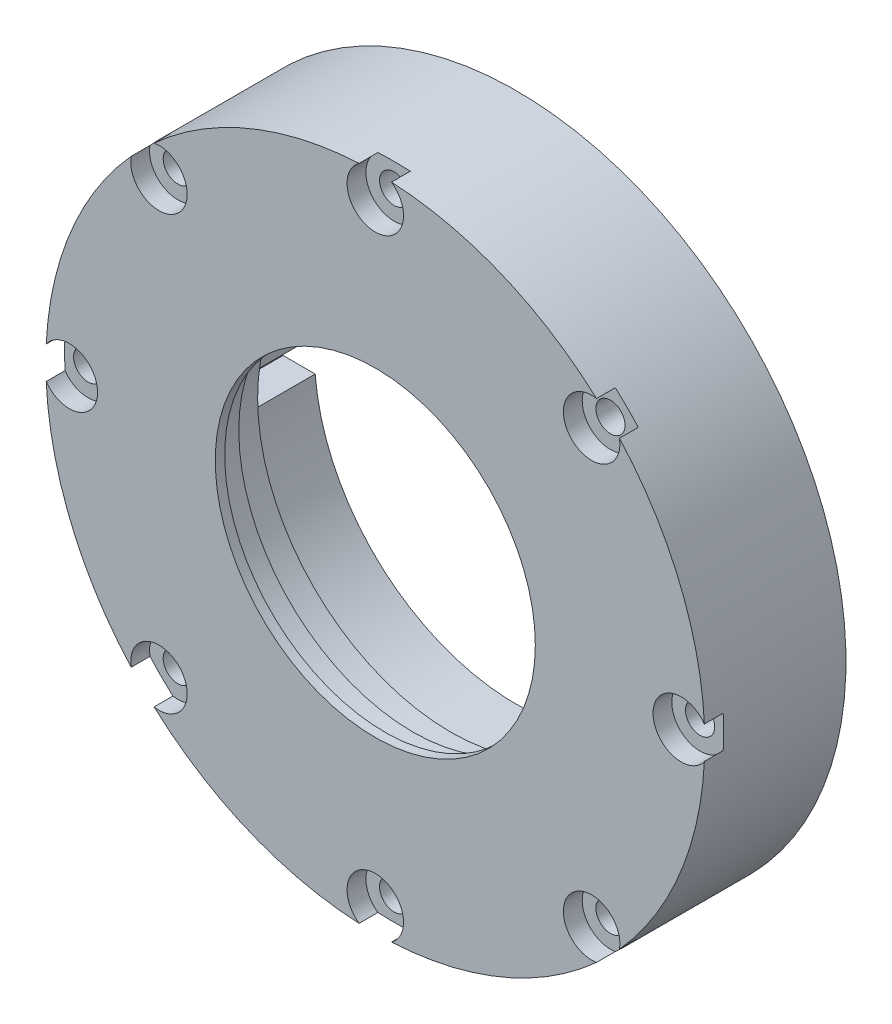
from build123d import *

# Parameters (mm, degrees)
SKETCH_1_R          = 35
SKETCH_1_R_2        = 18.5
EXTRUDE_1_DEPTH     = 3
SKETCH_5_R          = 35
SKETCH_5_R_2        = 17
EXTRUDE_3_DEPTH     = 1
EXTRUDE_START       = 4
SKETCH_7_R          = 35
SKETCH_7_R_2        = 21.45
EXTRUDE_4_DEPTH     = 4
EXTRUDE_START_2     = 7
SKETCH_9_R          = 35
EXTRUDE_6_DEPTH     = 7
SKETCH_12_R         = 1.55
CUT_EXTRUDE_1_DEPTH = 52.720402164
SKETCH_13_R         = 3
CUT_EXTRUDE_2_DEPTH = 2
SKETCH_15_R         = 1.55
CUT_EXTRUDE_3_DEPTH = 52.720402164
SKETCH_16_R         = 3
CUT_EXTRUDE_4_DEPTH = 2
SKETCH_17_R         = 21.45
SKETCH_17_R_2       = 20.5
EXTRUDE_7_DEPTH     = 4


with BuildPart() as part:
    # 草图1 → 凸台-拉伸1 (new body)
    with BuildSketch(Plane.XY):
        Circle(SKETCH_1_R)
        Circle(SKETCH_1_R_2, mode=Mode.SUBTRACT)
    extrude(amount=EXTRUDE_1_DEPTH)

    # 草图5 → 凸台-拉伸3 (add)
    with BuildSketch(Plane.XY.offset(3)):
        Circle(SKETCH_5_R)
        Circle(SKETCH_5_R_2, mode=Mode.SUBTRACT)
    extrude(amount=EXTRUDE_3_DEPTH)

    # 草图7 → 凸台-拉伸4 (add)
    with BuildSketch(Plane(origin=(0, 0, 0), x_dir=(-1, 0, 0), z_dir=(0, 0, -1)).offset(EXTRUDE_START)):
        Circle(SKETCH_7_R)
        Circle(SKETCH_7_R_2, mode=Mode.SUBTRACT)
    extrude(amount=-EXTRUDE_4_DEPTH)

    # 草图9 → 凸台-拉伸6 (add)
    with BuildSketch(Plane(origin=(0, 0, -4), x_dir=(-1, 0, 0), z_dir=(0, 0, -1)).offset(EXTRUDE_START_2)):
        Circle(SKETCH_9_R)
        with BuildLine():
            Line((24.8, 1.75), (24.8, 0))
            Line((24.8, 0), (24.8, -1.75))
            Line((24.8, -1.75), (21.382497565, -1.75))
            ThreePointArc((21.382497565, -1.75), (0, -21.453990354), (-21.382497565, -1.75))
            Line((-21.382497565, -1.75), (-24.8, -1.75))
            Line((-24.8, -1.75), (-24.8, 1.75))
            Line((-24.8, 1.75), (-21.382497565, 1.75))
            ThreePointArc((-21.382497565, 1.75), (0, 21.453990354), (21.382497565, 1.75))
            Line((21.382497565, 1.75), (24.8, 1.75))
        make_face(mode=Mode.SUBTRACT)
    extrude(amount=-EXTRUDE_6_DEPTH)

    # 草图12 → 切除-拉伸1 (cut, through all)
    with BuildSketch(Plane.XY.offset(4)):
        with Locations((0, 32.5)):
            Circle(SKETCH_12_R)
        with Locations((-32.5, 0)):
            Circle(SKETCH_12_R)
        with Locations((0, -32.5)):
            Circle(SKETCH_12_R)
        with Locations((32.5, 0)):
            Circle(SKETCH_12_R)
    extrude(amount=-CUT_EXTRUDE_1_DEPTH, mode=Mode.SUBTRACT)

    # 草图13 → 切除-拉伸2 (cut)
    with BuildSketch(Plane.XY.offset(4)):
        with Locations((0, 32.5)):
            Circle(SKETCH_13_R)
        with Locations((32.5, 0)):
            Circle(SKETCH_13_R)
        with Locations((0, -32.5)):
            Circle(SKETCH_13_R)
        with Locations((-32.5, 0)):
            Circle(SKETCH_13_R)
    extrude(amount=-CUT_EXTRUDE_2_DEPTH, mode=Mode.SUBTRACT)

    # 草图15 → 切除-拉伸3 (cut, through all)
    with BuildSketch(Plane.XY.offset(4)):
        with Locations((22.980970389, 22.980970389)):
            Circle(SKETCH_15_R)
        with Locations((22.980970389, -22.980970389)):
            Circle(SKETCH_15_R)
        with Locations((-22.980970389, -22.980970389)):
            Circle(SKETCH_15_R)
        with Locations((-22.980970389, 22.980970389)):
            Circle(SKETCH_15_R)
    extrude(amount=-CUT_EXTRUDE_3_DEPTH, mode=Mode.SUBTRACT)

    # 草图16 → 切除-拉伸4 (cut)
    with BuildSketch(Plane.XY.offset(4)):
        with Locations((22.980970389, 22.980970389)):
            Circle(SKETCH_16_R)
        with Locations((22.980970389, -22.980970389)):
            Circle(SKETCH_16_R)
        with Locations((-22.980970389, -22.980970389)):
            Circle(SKETCH_16_R)
        with Locations((-22.980970389, 22.980970389)):
            Circle(SKETCH_16_R)
    extrude(amount=-CUT_EXTRUDE_4_DEPTH, mode=Mode.SUBTRACT)

    # 草图17 → 凸台-拉伸7 (add)
    with BuildSketch(Plane(origin=(0, 0, 0), x_dir=(-1, 0, 0), z_dir=(0, 0, -1)).offset(EXTRUDE_START)):
        Circle(SKETCH_17_R)
        Circle(SKETCH_17_R_2, mode=Mode.SUBTRACT)
    extrude(amount=-EXTRUDE_7_DEPTH)


solid = part.part
